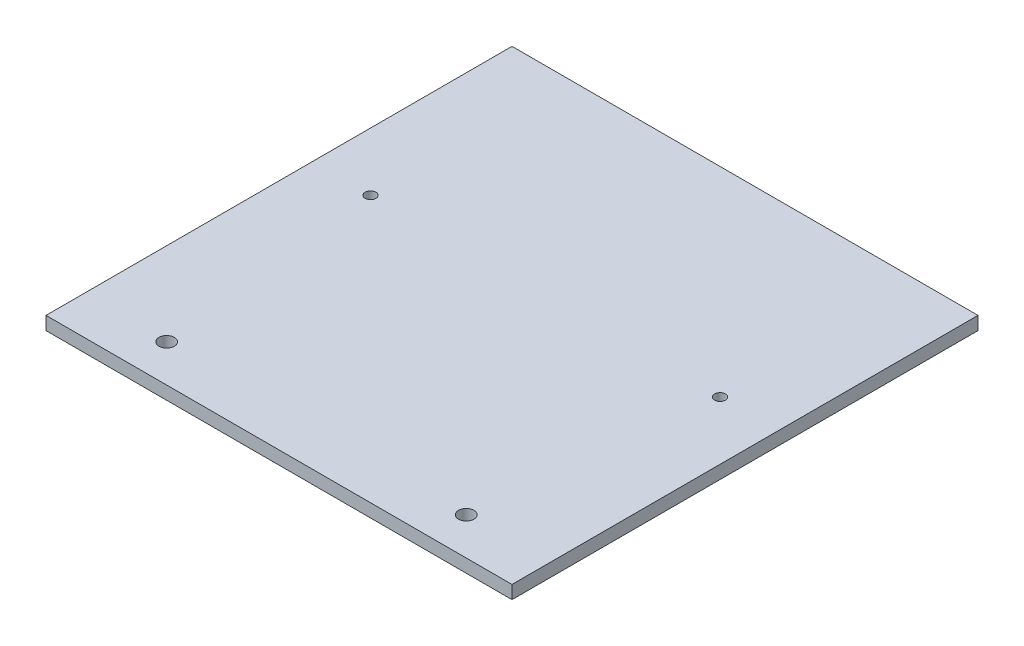
from build123d import *

# Parameters (mm, degrees)
ESQUISSE1_W          = 112
ESQUISSE1_H          = 112
BOSS_EXTRU_1_DEPTH   = 3.175
D_GAGEMENT_M41_D     = 3.7
D_GAGEMENT_M41_DEPTH = 3.175
D_GAGEMENT_M41_TIP   = 1.111592145
D_GAGEMENT_M32_D     = 2.6
D_GAGEMENT_M32_DEPTH = 3.175
D_GAGEMENT_M32_TIP   = 0.781118805


with BuildPart() as part:
    # Esquisse1 → Boss.-Extru.1 (new body)
    with BuildSketch(Plane(origin=(0, 0, 0), x_dir=(1, 0, 0), z_dir=(0, 1, 0))):
        Rectangle(ESQUISSE1_W, ESQUISSE1_H)
    extrude(amount=BOSS_EXTRU_1_DEPTH)

    # Dégagement M41
    with Locations(Plane(origin=(0, 3.175, 0), x_dir=(1, 0, 0), z_dir=(0, 1, 0))):
        with Locations((-36, -47), (36, -47)):
            Hole(D_GAGEMENT_M41_D / 2, depth=D_GAGEMENT_M41_DEPTH)
            with Locations((0, 0, -(D_GAGEMENT_M41_DEPTH + D_GAGEMENT_M41_TIP / 2))):  # 118° drill point
                Cone(0, D_GAGEMENT_M41_D / 2, D_GAGEMENT_M41_TIP, mode=Mode.SUBTRACT)

    # Dégagement M32
    with Locations(Plane(origin=(0, 3.175, 0), x_dir=(1, 0, 0), z_dir=(0, 1, 0))):
        with Locations((42, 8), (-42, 8)):
            Hole(D_GAGEMENT_M32_D / 2, depth=D_GAGEMENT_M32_DEPTH)
            with Locations((0, 0, -(D_GAGEMENT_M32_DEPTH + D_GAGEMENT_M32_TIP / 2))):  # 118° drill point
                Cone(0, D_GAGEMENT_M32_D / 2, D_GAGEMENT_M32_TIP, mode=Mode.SUBTRACT)


solid = part.part
